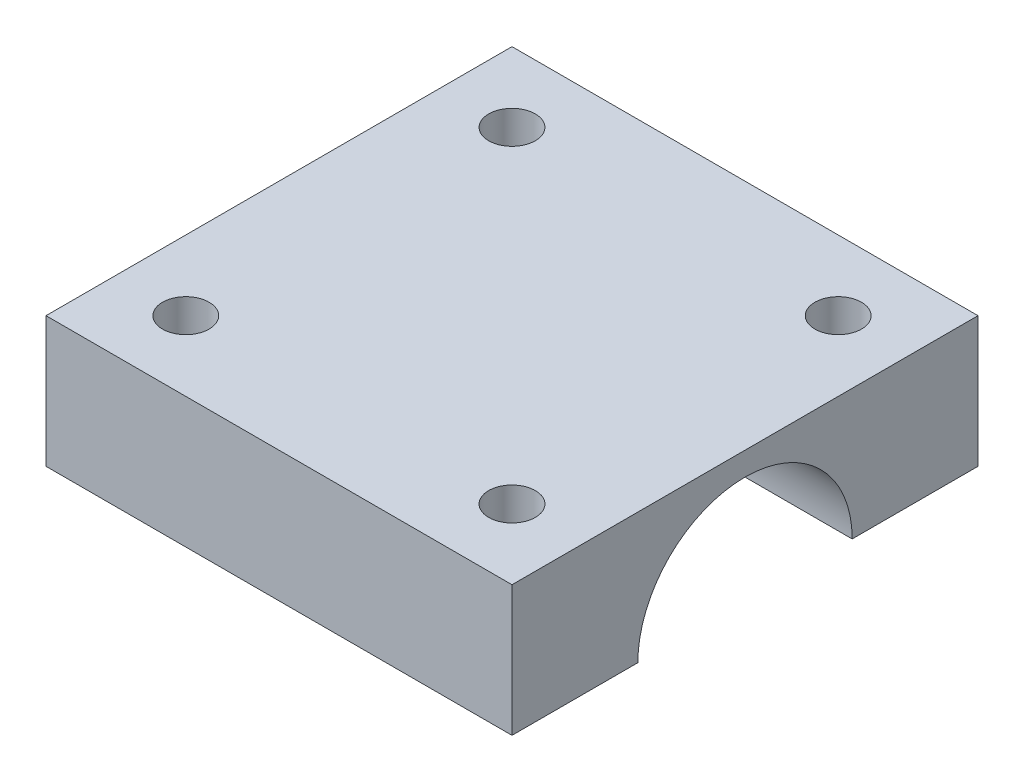
from build123d import *

# Parameters (mm, degrees)
SKETCH_1_W          = 50
SKETCH_1_H          = 50
SKETCH_1_R          = 2.5
EXTRUDE_1_DEPTH     = 14
SKETCH_2_R          = 11.5
CUT_EXTRUDE_1_DEPTH = 58.628118137


with BuildPart() as part:
    # 草图1 → 凸台-拉伸1 (new body)
    with BuildSketch(Plane(origin=(0, 0, 0), x_dir=(1, 0, 0), z_dir=(0, 1, 0))):
        Rectangle(SKETCH_1_W, SKETCH_1_H)
        with Locations(Location((-17.5, 17.5, 0), (0, 0, 270))):
            Circle(SKETCH_1_R, mode=Mode.SUBTRACT)
        with Locations(Location((-17.5, -17.5, 0), (0, 0, 270))):
            Circle(SKETCH_1_R, mode=Mode.SUBTRACT)
        with Locations(Location((17.5, 17.5, 0), (0, 0, 270))):
            Circle(SKETCH_1_R, mode=Mode.SUBTRACT)
        with Locations(Location((17.5, -17.5, 0), (0, 0, 270))):
            Circle(SKETCH_1_R, mode=Mode.SUBTRACT)
    extrude(amount=EXTRUDE_1_DEPTH)

    # 草图2 → 切除-拉伸1 (cut, through all)
    with BuildSketch(Plane.ZY.offset(25)):
        Circle(SKETCH_2_R)
    extrude(amount=-CUT_EXTRUDE_1_DEPTH, mode=Mode.SUBTRACT)


solid = part.part
